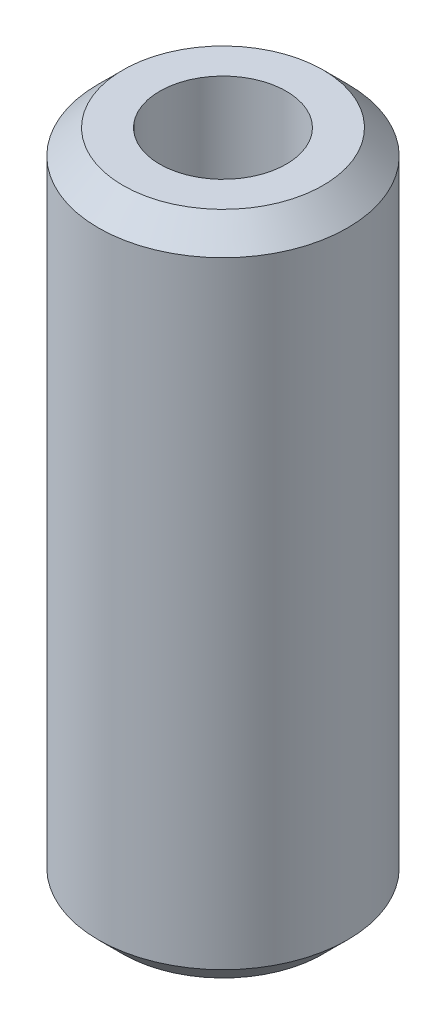
from build123d import *

# Parameters (mm, degrees)
SZKIC1_R                    = 12.7
SZKIC1_R_2                  = 6.45
DODANIE_WYCI_GNI_CIE1_DEPTH = 67.85
SFAZOWANIE1_SIZE            = 2.5


with BuildPart() as part:
    # Szkic1 → Dodanie-wyciągnięcie1 (new body)
    with BuildSketch(Plane(origin=(0, 0, 0), x_dir=(1, 0, 0), z_dir=(0, 1, 0))):
        with Locations(Location((0, 0, 0), (0, 0, 270))):
            Circle(SZKIC1_R)
        with Locations(Location((0, 0, 0), (0, 0, 270))):
            Circle(SZKIC1_R_2, mode=Mode.SUBTRACT)
    extrude(amount=DODANIE_WYCI_GNI_CIE1_DEPTH)

    # Sfazowanie1
    sfazowanie1_edges = [part.edges().sort_by_distance(p)[0] for p in [
        (0, 0, -12.7),
        (0, 67.85, -12.7),
    ]]
    chamfer(sfazowanie1_edges, length=SFAZOWANIE1_SIZE)


solid = part.part
